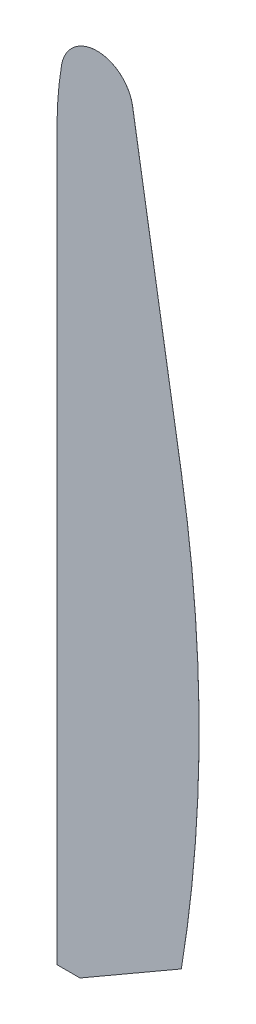
from build123d import *

# Parameters (mm, degrees)
BOSS_EXTRUDE1_DEPTH = 0.01


with BuildPart() as part:
    # Sketch1 → Boss-Extrude1 (new body)
    with BuildSketch(Plane(origin=(0, 0, 0), x_dir=(0, 1, 0), z_dir=(0, 0, 1))):
        with BuildLine():
            Line((0, 0), (158.1, 0))
            ThreePointArc((158.1, 0), (164.07027634, -0.246232884), (170, -0.983259015))
            ThreePointArc((170, -0.983259015), (176.547771398, -8.710531742), (170, -16.437804469))
            Line((170, -16.437804469), (106.248114269, -27.045454545))
            ThreePointArc((106.248114269, -27.045454545), (59.488031692, -30.909090909), (12.727949116, -27.045454545))
            Line((12.727949116, -27.045454545), (0, -5))
            Line((0, -5), (0, 0))
        make_face()
    extrude(amount=BOSS_EXTRUDE1_DEPTH)


solid = part.part
